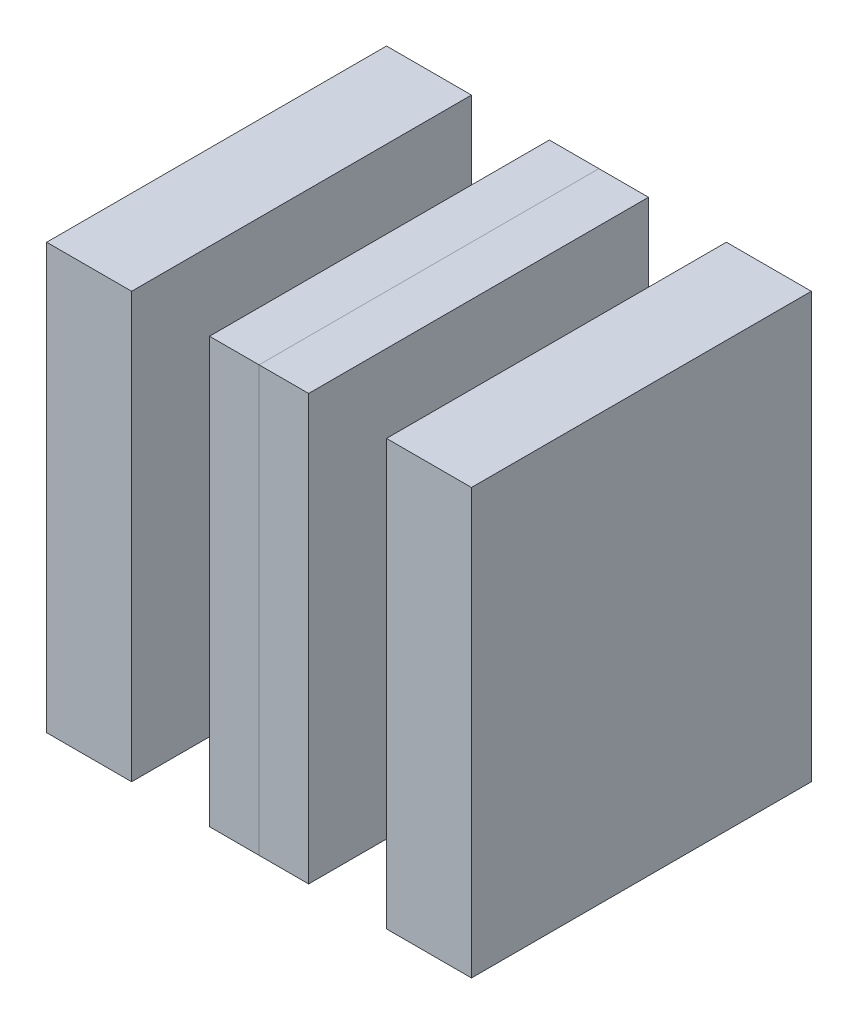
from build123d import *

# Parameters (mm, degrees)
SKETCH1_W             = 3
SKETCH1_H             = 15
BOSS_EXTRUDE1_DEPTH   = 12
SKETCH1_W_2           = 1.75
BOSS_EXTRUDE1_2_DEPTH = 12


with BuildPart() as part:
    # Sketch1 → Boss-Extrude1 (new body)
    with BuildSketch(Plane.XY):
        with Locations((1.5, 7.5)):
            Rectangle(SKETCH1_W, SKETCH1_H)
    extrude(amount=BOSS_EXTRUDE1_DEPTH)


with BuildPart() as body_2:
    # Sketch1 → Boss-Extrude1 2 (new body)
    with BuildSketch(Plane.XY):
        with Locations((6.625, 7.5)):
            Rectangle(SKETCH1_W_2, SKETCH1_H)
    extrude(amount=BOSS_EXTRUDE1_2_DEPTH)


with BuildPart() as body_3:
    # Mirror1: mirrored copy
    add(body_2.part.mirror(Plane(origin=(7.5, 15, 12), x_dir=(0, 0, 1), z_dir=(-1, 0, 0))))


with BuildPart() as body_4:
    # Mirror1 2: mirrored copy
    add(part.part.mirror(Plane(origin=(7.5, 15, 12), x_dir=(0, 0, 1), z_dir=(-1, 0, 0))))


solid = Compound([part.part, body_2.part, body_3.part, body_4.part])
